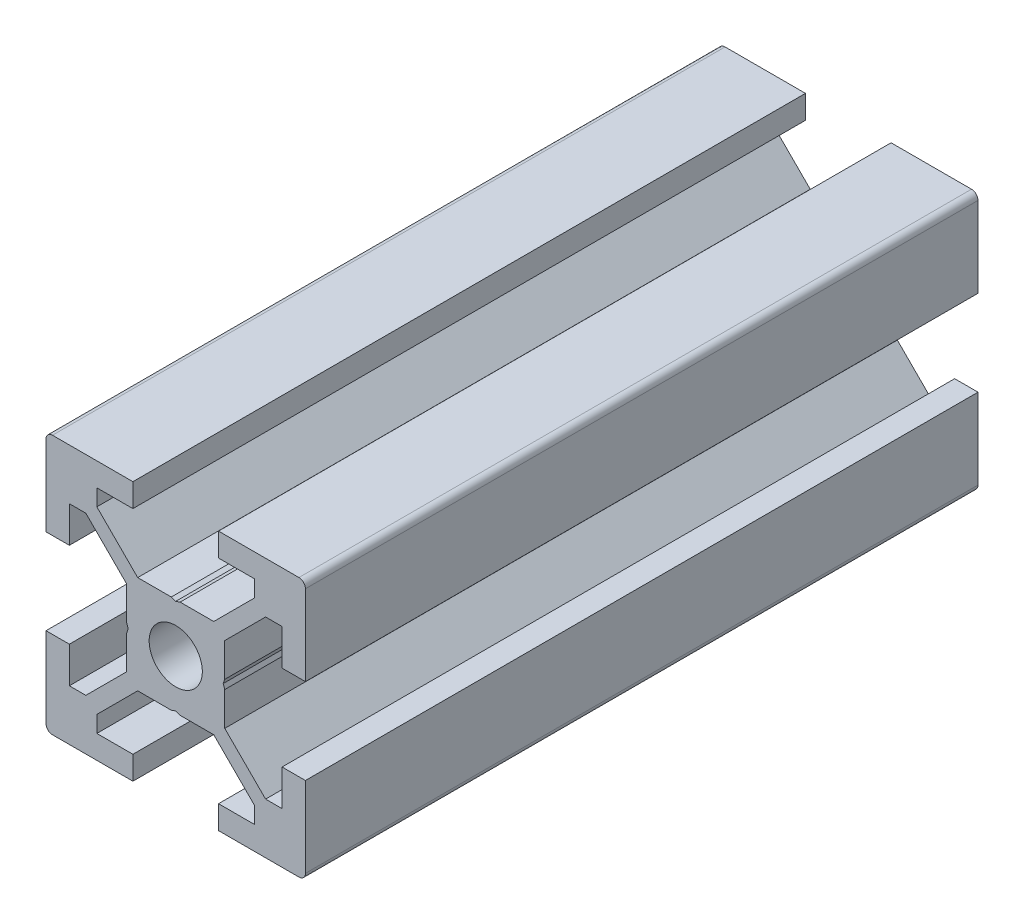
from build123d import *

# Parameters (mm, degrees)
SKETCH1_R           = 2.05
BOSS_EXTRUDE1_DEPTH = 51.85
FILLET1_R           = 0.5


with BuildPart() as part:
    # Sketch1 → Boss-Extrude1 (new body)
    with BuildSketch(Plane.XY):
        Polygon((-3.3, 10), (-3.3, 8.2), (-6.08, 8.2), (-6.08, 6.928528137), (-2.931471863, 3.78), (-0.34, 3.78), (0, 3.66), (0.34, 3.78), (2.931471863, 3.78), (6.08, 6.928528137), (6.08, 8.2), (3.3, 8.2), (3.3, 10), (10, 10), (10, 3.3), (8.2, 3.3), (8.2, 6.08), (6.928528137, 6.08), (3.78, 2.931471863), (3.78, 0.34), (3.66, 0), (3.78, -0.34), (3.78, -2.931471863), (6.928528137, -6.08), (8.2, -6.08), (8.2, -3.3), (10, -3.3), (10, -10), (3.3, -10), (3.3, -8.2), (6.08, -8.2), (6.08, -6.928528137), (2.931471863, -3.78), (0.34, -3.78), (0, -3.66), (-0.34, -3.78), (-2.931471863, -3.78), (-6.08, -6.928528137), (-6.08, -8.2), (-3.3, -8.2), (-3.3, -10), (-10, -10), (-10, -3.3), (-8.2, -3.3), (-8.2, -6.08), (-6.928528137, -6.08), (-3.78, -2.931471863), (-3.78, -0.34), (-3.66, 0), (-3.78, 0.34), (-3.78, 2.931471863), (-6.928528137, 6.08), (-8.2, 6.08), (-8.2, 3.3), (-10, 3.3), (-10, 10), align=None)
        with Locations(Location((0, 0, 0), (0, 0, 180))):
            Circle(SKETCH1_R, mode=Mode.SUBTRACT)
    extrude(amount=BOSS_EXTRUDE1_DEPTH)

    # Fillet1
    fillet1_edges = [part.edges().sort_by_distance(p)[0] for p in [
        (10, 10, 25.925),
        (10, -10, 25.925),
        (-10, -10, 25.925),
        (-10, 10, 25.925),
    ]]
    fillet(fillet1_edges, radius=FILLET1_R)


solid = part.part
